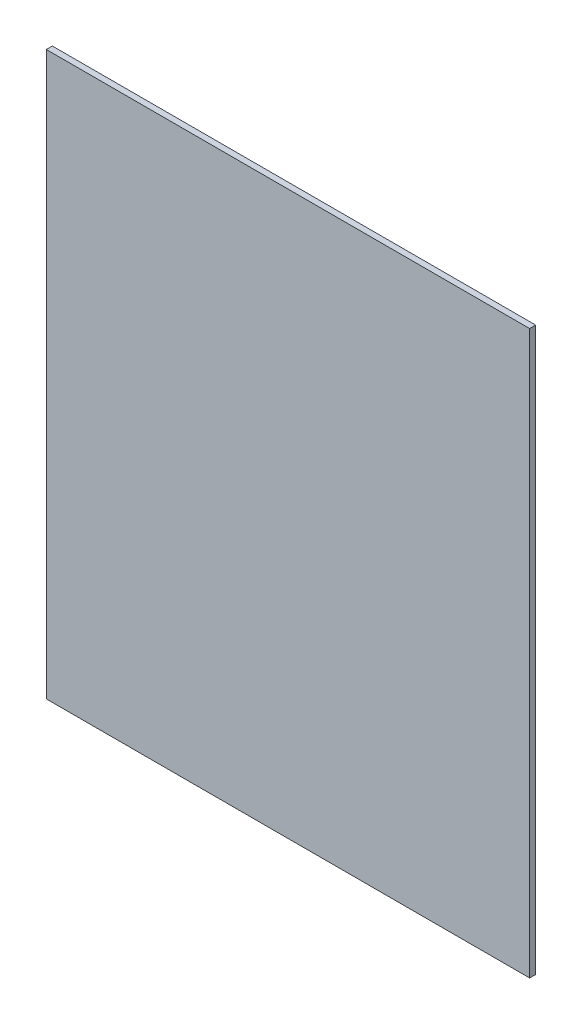
from build123d import *

# Parameters (mm, degrees)
SKETCH1_W           = 127
SKETCH1_H           = 147.7772
BOSS_EXTRUDE1_DEPTH = 1.5875


with BuildPart() as part:
    # Sketch1 → Boss-Extrude1 (new body)
    with BuildSketch(Plane.XY):
        Rectangle(SKETCH1_W, SKETCH1_H)
    extrude(amount=BOSS_EXTRUDE1_DEPTH)


solid = part.part
